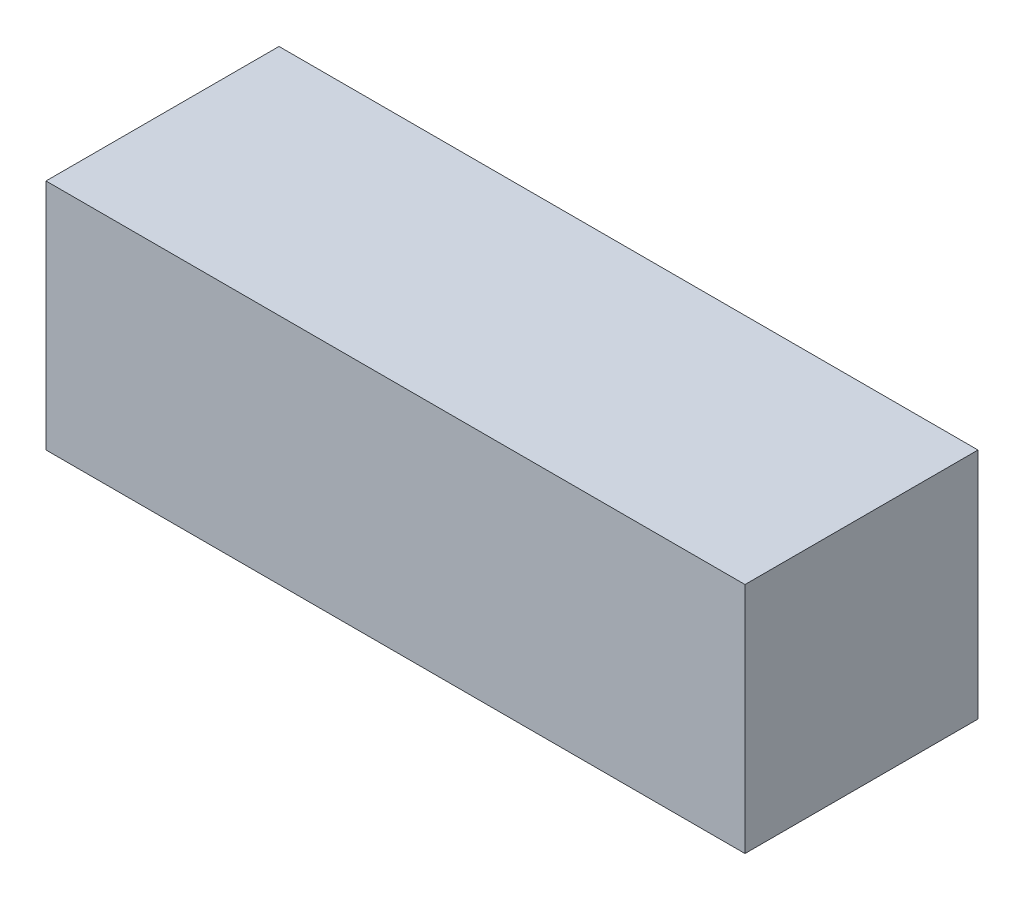
from build123d import *

# Parameters (mm, degrees)
SKETCH_1_W      = 120
SKETCH_1_H      = 40
EXTRUDE_1_DEPTH = 40


with BuildPart() as part:
    # 草图1 → 凸台-拉伸1 (new body)
    with BuildSketch(Plane.XY):
        Rectangle(SKETCH_1_W, SKETCH_1_H)
    extrude(amount=EXTRUDE_1_DEPTH)


solid = part.part
